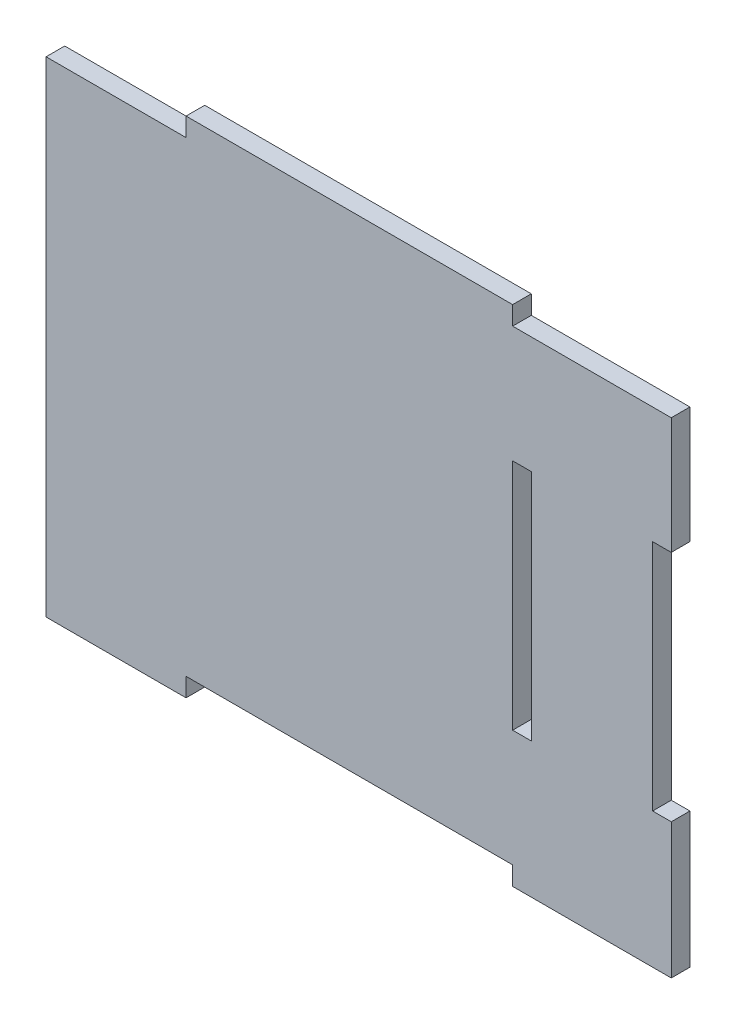
from build123d import *

# Parameters (mm, degrees)
SKETCH_1_W      = 4
SKETCH_1_H      = 50
EXTRUDE_1_DEPTH = 4


with BuildPart() as part:
    # Эскиз1 → Бобышка-Вытянуть1 (new body)
    with BuildSketch(Plane.XY):
        Polygon((-100, 77.20842051), (-130, 77.20842051), (-130, -22.79157949), (-130, -26.79157949), (-100, -26.79157949), (-100, -22.79157949), (-30, -22.79157949), (-30, -26.79157949), (0, -26.79157949), (4, -26.79157949), (4, 2.20842051), (0, 2.20842051), (0, 52.20842051), (4, 52.20842051), (4, 77.20842051), (0, 77.20842051), (-30, 77.20842051), (-30, 81.20842051), (-100, 81.20842051), align=None)
        with Locations((-28, 27.20842051)):
            Rectangle(SKETCH_1_W, SKETCH_1_H, mode=Mode.SUBTRACT)
    extrude(amount=EXTRUDE_1_DEPTH)


solid = part.part
